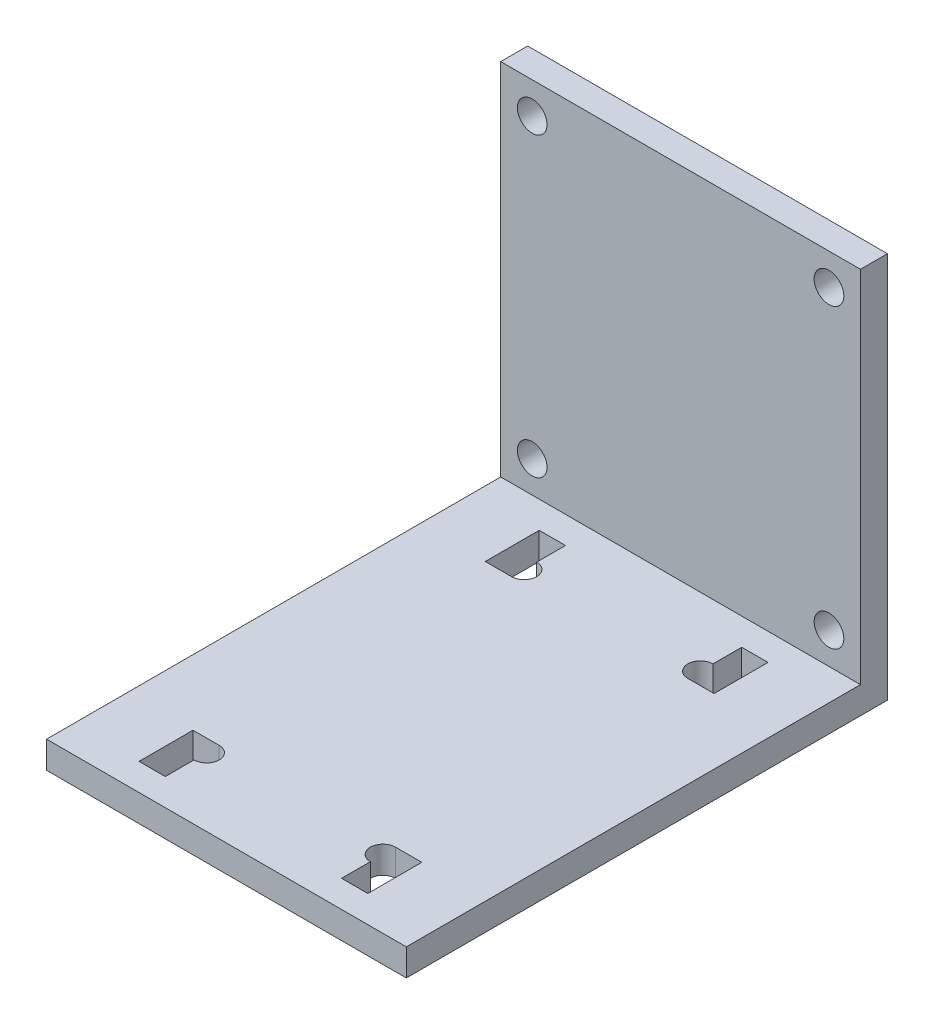
from build123d import *

# Parameters (mm, degrees)
SKETCH1_W           = 40
SKETCH1_H           = 40
BOSS_EXTRUDE1_DEPTH = 3
SKETCH2_R           = 1.65
CUT_EXTRUDE1_DEPTH  = 3
SKETCH3_W           = 40
SKETCH3_H           = 3
BOSS_EXTRUDE2_DEPTH = 3
SKETCH4_W           = 40
SKETCH4_H           = 50.5
BOSS_EXTRUDE3_DEPTH = 3


with BuildPart() as part:
    # Sketch1 → Boss-Extrude1 (new body)
    with BuildSketch(Plane.XY):
        with Locations((20, 20)):
            Rectangle(SKETCH1_W, SKETCH1_H)
    extrude(amount=BOSS_EXTRUDE1_DEPTH)

    # Sketch2 → Cut-Extrude1 (cut)
    with BuildSketch(Plane.XY.offset(3)):
        with Locations((3.5, 36.5)):
            Circle(SKETCH2_R)
        with Locations(Location((36.5, 36.5, 0), (0, 0, 180))):
            Circle(SKETCH2_R)
        with Locations((36.5, 3.5)):
            Circle(SKETCH2_R)
        with Locations(Location((3.5, 3.5, 0), (0, 0, 180))):
            Circle(SKETCH2_R)
    extrude(amount=-CUT_EXTRUDE1_DEPTH, mode=Mode.SUBTRACT)

    # Sketch3 → Boss-Extrude2 (add)
    with BuildSketch(Plane.XY.offset(3)):
        with Locations((20, -1.5)):
            Rectangle(SKETCH3_W, SKETCH3_H)
    extrude(amount=-BOSS_EXTRUDE2_DEPTH)

    # Sketch4 → Boss-Extrude3 (add)
    with BuildSketch(Plane.XZ.offset(3)):
        with Locations((20, 28.25)):
            Rectangle(SKETCH4_W, SKETCH4_H)
        with BuildLine():
            Line((7.28, 50.5), (10.2, 50.5))
            Line((10.2, 50.5), (10.2, 47.3))
            ThreePointArc((10.2, 47.3), (11.6, 45.9), (10.2, 44.5))
            Line((10.2, 44.5), (7.28, 44.5))
            Line((7.28, 44.5), (7.28, 50.5))
        make_face(mode=Mode.SUBTRACT)
        with BuildLine():
            Line((32.72, 50.5), (32.72, 44.5))
            Line((32.72, 44.5), (29.8, 44.5))
            ThreePointArc((29.8, 44.5), (28.4, 45.9), (29.8, 47.3))
            Line((29.8, 47.3), (29.8, 50.5))
            Line((29.8, 50.5), (32.72, 50.5))
        make_face(mode=Mode.SUBTRACT)
        with BuildLine():
            Line((32.72, 6), (29.8, 6))
            Line((29.8, 6), (29.8, 9.2))
            ThreePointArc((29.8, 9.2), (28.4, 10.6), (29.8, 12))
            Line((29.8, 12), (32.72, 12))
            Line((32.72, 12), (32.72, 6))
        make_face(mode=Mode.SUBTRACT)
        with BuildLine():
            Line((7.28, 6), (7.28, 12))
            Line((7.28, 12), (10.2, 12))
            ThreePointArc((10.2, 12), (11.6, 10.6), (10.2, 9.2))
            Line((10.2, 9.2), (10.2, 6))
            Line((10.2, 6), (7.28, 6))
        make_face(mode=Mode.SUBTRACT)
    extrude(amount=-BOSS_EXTRUDE3_DEPTH)


solid = part.part
